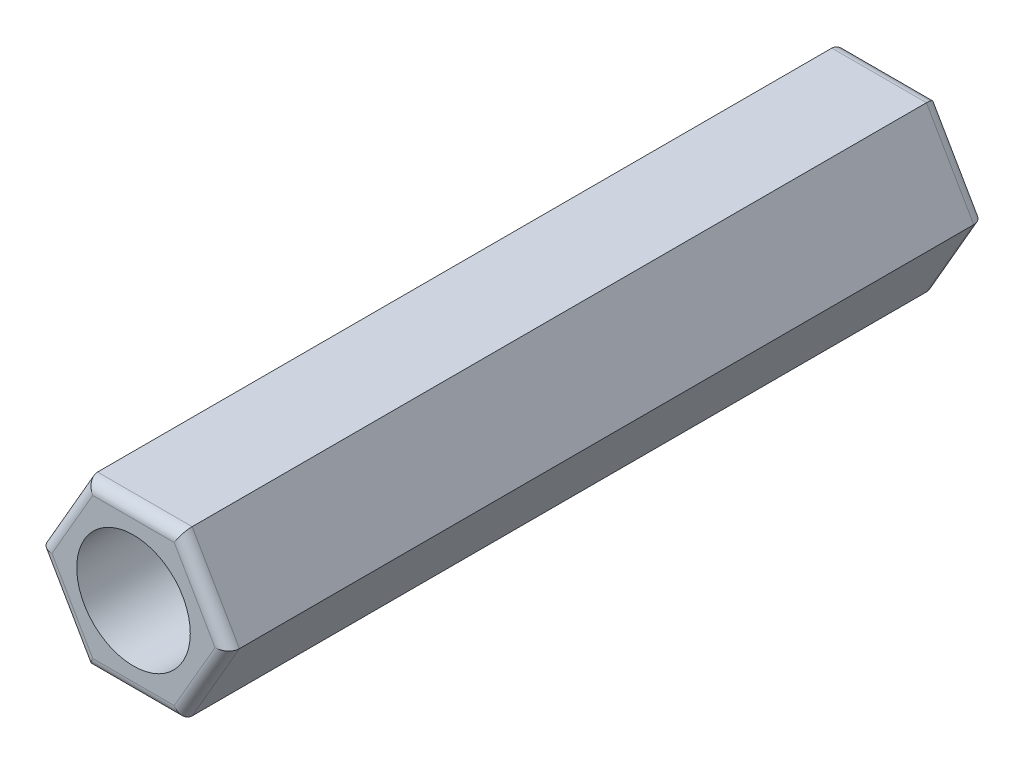
from build123d import *

# Parameters (mm, degrees)
SKETCH1_R           = 1.5
BOSS_EXTRUDE1_DEPTH = 20
FILLET5_R           = 0.3
FILLET6_R           = 0.3


with BuildPart() as part:
    # Sketch1 → Boss-Extrude1 (new body)
    with BuildSketch(Plane.XY):
        Polygon((2.5, 0), (1.25, 2.165063509), (-1.25, 2.165063509), (-2.5, 0), (-1.25, -2.165063509), (1.25, -2.165063509), align=None)
        Circle(SKETCH1_R, mode=Mode.SUBTRACT)
    extrude(amount=BOSS_EXTRUDE1_DEPTH)

    # Fillet5
    fillet5_edges = [part.edges().sort_by_distance(p)[0] for p in [
        (0, 2.165063509, 20),
        (-1.875, 1.082531755, 20),
        (-1.875, -1.082531755, 20),
        (0, -2.165063509, 20),
        (1.875, -1.082531755, 20),
        (1.875, 1.082531755, 20),
    ]]
    fillet(fillet5_edges, radius=FILLET5_R)

    # Fillet6
    fillet6_edges = [part.edges().sort_by_distance(p)[0] for p in [
        (0, -2.165063509, 0),
        (-1.875, -1.082531755, 0),
        (-1.875, 1.082531755, 0),
        (0, 2.165063509, 0),
        (1.875, 1.082531755, 0),
        (1.875, -1.082531755, 0),
    ]]
    fillet(fillet6_edges, radius=FILLET6_R)


solid = part.part
